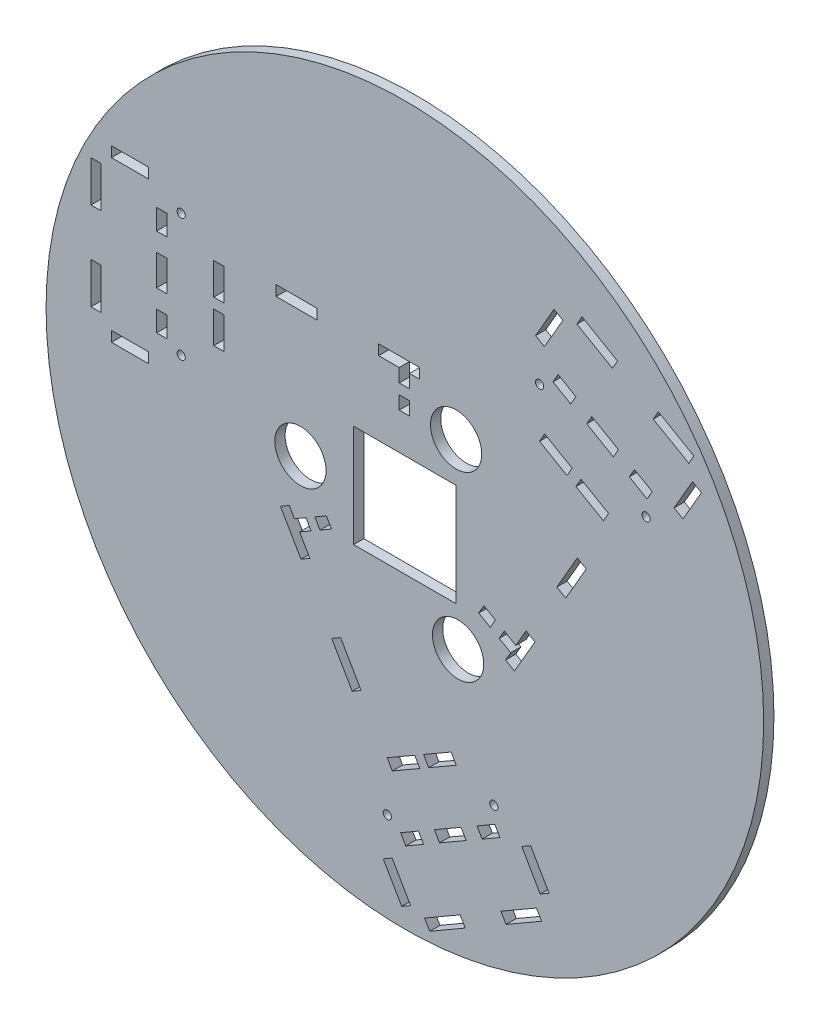
from build123d import *

# Parameters (mm, degrees)
ESQUISSE1_R                = 175
BOSS_EXTRU_1_DEPTH         = 5
ESQUISSE2_W                = 18
ESQUISSE2_H                = 5
ESQUISSE2_W_2              = 5
ESQUISSE2_H_2              = 20
ESQUISSE2_H_3              = 10
ESQUISSE2_H_4              = 15
ESQUISSE2_H_5              = 15.5
ESQUISSE2_W_3              = 20
ESQUISSE2_H_6              = 6.5
ENL_V_MAT_EXTRU_1_DEPTH    = 5
ESQUISSE6_R                = 12.5
ESQUISSE6_W                = 50
ESQUISSE6_H                = 50
ENL_V_MAT_EXTRU_6_DEPTH    = 5
TROUS_DE_CENTRAGE_4_0MM1_D = 4


with BuildPart() as part:
    # Esquisse1 → Boss.-Extru.1 (new body)
    with BuildSketch(Plane.XY):
        with Locations((148.080426897, -12.110171348)):
            Circle(ESQUISSE1_R)
    extrude(amount=BOSS_EXTRU_1_DEPTH)

    # Esquisse2 → Enlèv. mat.-Extru.1 (cut)
    with BuildSketch(Plane.XY.offset(5)):
        Polygon((135.311788567, 53.777441362), (135.311788567, 48.777441362), (145.311788567, 48.777441362), (145.311788567, 42.277441362), (150.311788567, 42.277441362), (150.311788567, 48.777441362), (155.311788567, 48.777441362), (155.311788567, 53.777441362), align=None)
        with Locations((14, 69.777441362)):
            Rectangle(ESQUISSE2_W, ESQUISSE2_H)
        with Locations((-2.5, 52.277441362)):
            Rectangle(ESQUISSE2_W_2, ESQUISSE2_H_2)
        with Locations((-2.5, 9.277441362)):
            Rectangle(ESQUISSE2_W_2, ESQUISSE2_H_2)
        with Locations((14, -8.222558638)):
            Rectangle(ESQUISSE2_W, ESQUISSE2_H)
        with Locations((29.5, 9.277441362)):
            Rectangle(ESQUISSE2_W_2, ESQUISSE2_H_3)
        with Locations((29.5, 30.777441362)):
            Rectangle(ESQUISSE2_W_2, ESQUISSE2_H_4)
        with Locations((29.5, 52.277441362)):
            Rectangle(ESQUISSE2_W_2, ESQUISSE2_H_3)
        with Locations((57.36, 41.027441362)):
            Rectangle(ESQUISSE2_W_2, ESQUISSE2_H_5)
        with Locations((57.36, 20.527441362)):
            Rectangle(ESQUISSE2_W_2, ESQUISSE2_H_5)
        with Locations((95.311788567, 51.277441362)):
            Rectangle(ESQUISSE2_W_3, ESQUISSE2_H)
        with Locations((147.811788567, 34.027441362)):
            Rectangle(ESQUISSE2_W_2, ESQUISSE2_H_6)
        Polygon((292.702456717, 69.607306773), (283.702456717, 54.018849505), (279.372329698, 56.518849505), (288.372329698, 72.107306773), align=None)
        Polygon((289.042202679, 83.267560811), (286.542202679, 78.937433792), (269.221694603, 88.937433792), (271.721694603, 93.267560811), align=None)
        Polygon((251.803110316, 104.767560811), (249.303110316, 100.437433792), (231.982602241, 110.437433792), (234.482602241, 114.767560811), align=None)
        Polygon((225.152475222, 108.607306773), (216.152475222, 93.018849505), (211.822348203, 95.518849505), (220.822348203, 111.107306773), align=None)
        Polygon((231.472983297, 79.55474789), (228.972983297, 75.224620871), (220.31272926, 80.224620871), (222.81272926, 84.55474789), align=None)
        Polygon((252.257592988, 67.55474789), (249.757592988, 63.224620871), (236.767211932, 70.724620871), (239.267211932, 75.05474789), align=None)
        Polygon((268.71207566, 58.05474789), (266.21207566, 53.724620871), (257.551821622, 58.724620871), (260.051821622, 63.05474789), align=None)
        Polygon((247.420859728, 38.17728014), (244.920859728, 33.847153121), (231.497465969, 41.597153121), (233.997465969, 45.92728014), align=None)
        Polygon((229.66733895, 48.42728014), (227.16733895, 44.097153121), (213.743945192, 51.847153121), (216.243945192, 56.17728014), align=None)
        Polygon((211.525092463, -33.996012539), (207.194965444, -31.496012539), (202.194965444, -40.156266577), (196.56580032, -36.906266577), (194.06580032, -41.236393596), (199.694965444, -44.486393596), (197.194965444, -48.816520615), (201.525092463, -51.316520615), align=None)
        Polygon((236.525092463, 9.30525765), (226.525092463, -8.015250425), (222.194965444, -5.515250425), (232.194965444, 11.80525765), align=None)
        Polygon((192.235673301, -34.406266577), (189.735673301, -38.736393596), (184.106508176, -35.486393596), (186.606508176, -31.156266577), align=None)
        Polygon((146.538823973, -178.215262181), (137.538823973, -162.626804912), (141.868950992, -160.126804912), (150.868950992, -175.715262181), align=None)
        Polygon((160.199078011, -181.875516218), (157.699078011, -177.545389199), (175.019586086, -167.545389199), (177.519586086, -171.875516218), align=None)
        Polygon((197.438170373, -160.375516218), (194.938170373, -156.045389199), (212.258678449, -146.045389199), (214.758678449, -150.375516218), align=None)
        Polygon((214.088805468, -139.215262181), (205.088805468, -123.626804912), (209.418932487, -121.126804912), (218.418932487, -136.715262181), align=None)
        Polygon((185.768297392, -130.162703297), (183.268297392, -125.832576278), (191.92855143, -120.832576278), (194.42855143, -125.162703297), align=None)
        Polygon((164.983687701, -142.162703297), (162.483687701, -137.832576278), (175.474068758, -130.332576278), (177.974068758, -134.662703297), align=None)
        Polygon((148.52920503, -151.662703297), (146.02920503, -147.332576278), (154.689459067, -142.332576278), (157.189459067, -146.662703297), align=None)
        Polygon((141.960420962, -123.285235548), (139.460420962, -118.955108529), (152.88381472, -111.205108529), (155.38381472, -115.535235548), align=None)
        Polygon((159.713941739, -113.035235548), (157.213941739, -108.705108529), (170.637335498, -100.955108529), (173.137335498, -105.285235548), align=None)
        Polygon((97.404399659, -56.111942869), (101.734526678, -53.611942869), (96.734526678, -44.951688831), (102.363691803, -41.701688831), (99.863691803, -37.371561812), (94.234526678, -40.621561812), (91.734526678, -36.291434793), (87.404399659, -38.791434793), align=None)
        Polygon((122.404399659, -99.413213058), (112.404399659, -82.092704982), (116.734526678, -79.592704982), (126.734526678, -96.913213058), align=None)
        Polygon((106.693818822, -39.201688831), (104.193818822, -34.871561812), (109.822983946, -31.621561812), (112.322983946, -35.951688831), align=None)
    extrude(amount=-ENL_V_MAT_EXTRU_1_DEPTH, mode=Mode.SUBTRACT)

    # Esquisse6 → Enlèv. mat.-Extru.6 (cut)
    with BuildSketch(Plane.XY.offset(5)):
        with Locations((173.06, 32.277441362)):
            Circle(ESQUISSE6_R)
        with Locations((174.031440566, -55.936922587)):
            Circle(ESQUISSE6_R)
        with Locations((97.149840124, -12.67103282)):
            Circle(ESQUISSE6_R)
        with Locations((148.080426897, -12.110171348)):
            Rectangle(ESQUISSE6_W, ESQUISSE6_H)
    extrude(amount=-ENL_V_MAT_EXTRU_6_DEPTH, mode=Mode.SUBTRACT)

    # Trous de centrage Ø4.0mm1 (through all)
    with Locations(Plane(origin=(148.080426897, -12.110171348, -78), x_dir=(0.999943388088008, -0.01064051780109604, 0), z_dir=(0, 0, -1))):
        with Locations((64.760887783, -88.716726196), (117.038685903, -59.271322076), (-109.849813586, -71.722814179), (-109.211382518, -11.726210894), (-7.188872317, 130.994136256), (44.450494734, 100.44293709)):
            Hole(TROUS_DE_CENTRAGE_4_0MM1_D / 2)


solid = part.part
